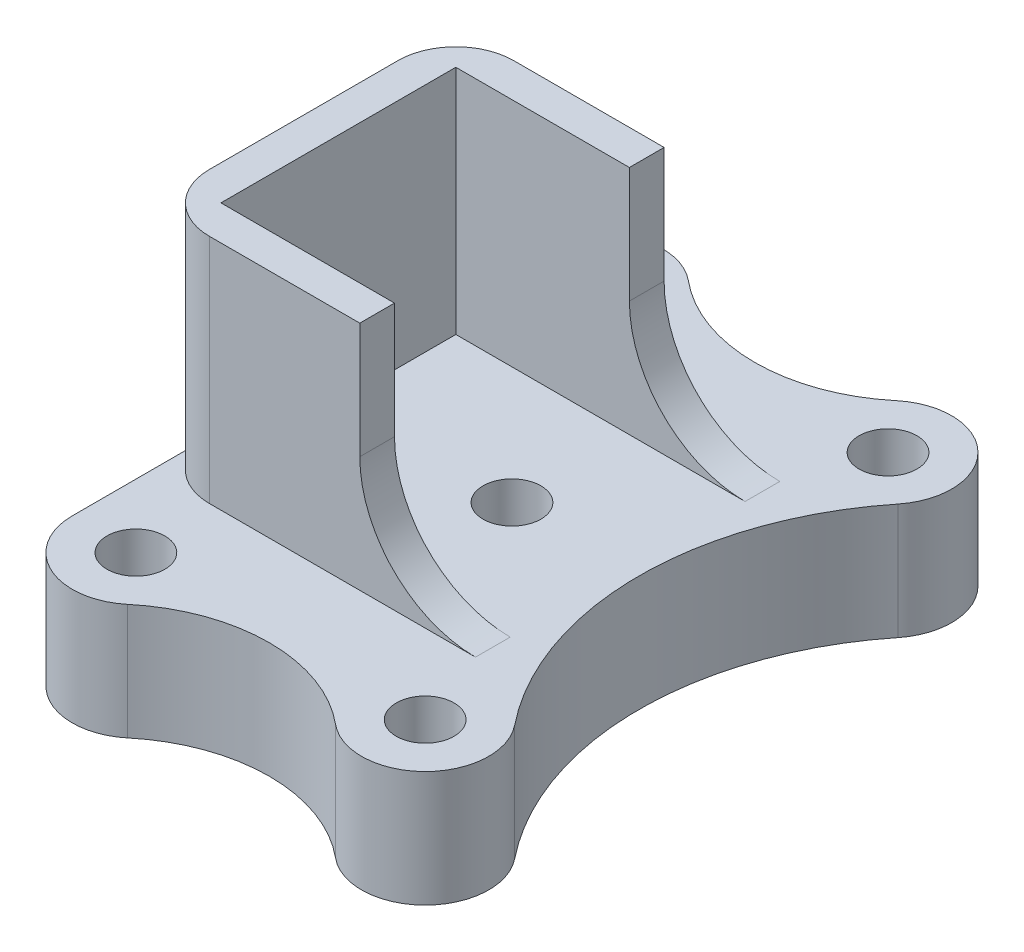
from build123d import *

# Parameters (mm, degrees)
SKETCH1_R           = 2.5
BOSS_EXTRUDE1_DEPTH = 10
SKETCH3_R           = 5.5
CUT_EXTRUDE1_DEPTH  = 4
BOSS_EXTRUDE2_DEPTH = 20
FILLET1_R           = 10
FILLET2_R           = 5


with BuildPart() as part:
    # Sketch1 → Boss-Extrude1 (new body)
    with BuildSketch(Plane(origin=(0, 0, 0), x_dir=(1, 0, 0), z_dir=(0, 1, 0))):
        with BuildLine():
            Line((-18, -20), (-18, 20))
            ThreePointArc((-18, 20), (-14.832854679, 24.980741817), (-8.978985802, 24.225217038))
            ThreePointArc((-8.978985802, 24.225217038), (0, 20.97437581), (8.978985802, 24.225217038))
            ThreePointArc((8.978985802, 24.225217038), (16.350007855, 23.927777936), (16.794778452, 16.564177238))
            ThreePointArc((16.794778452, 16.564177238), (10.984378813, 0), (16.794778452, -16.564177238))
            ThreePointArc((16.794778452, -16.564177238), (16.350007855, -23.927777936), (8.978985802, -24.225217038))
            ThreePointArc((8.978985802, -24.225217038), (0, -20.97437581), (-8.978985802, -24.225217038))
            ThreePointArc((-8.978985802, -24.225217038), (-14.832854679, -24.980741817), (-18, -20))
        make_face()
        with Locations(Location((-12.5, 20, 0), (0, 0, 270))):
            Circle(SKETCH1_R, mode=Mode.SUBTRACT)
        with Locations(Location((12.5, 20, 0), (0, 0, 90))):
            Circle(SKETCH1_R, mode=Mode.SUBTRACT)
        with Locations(Location((12.5, -20, 0), (0, 0, 270))):
            Circle(SKETCH1_R, mode=Mode.SUBTRACT)
        with Locations(Location((-12.5, -20, 0), (0, 0, 90))):
            Circle(SKETCH1_R, mode=Mode.SUBTRACT)
        with Locations(Location((0, 0, 0), (0, 0, 270))):
            Circle(SKETCH1_R, mode=Mode.SUBTRACT)
    extrude(amount=BOSS_EXTRUDE1_DEPTH)

    # Sketch3 → Cut-Extrude1 (cut)
    with BuildSketch(Plane.XZ):
        with Locations(Location((0, 0, 0), (0, 0, 270))):
            Circle(SKETCH3_R)
    extrude(amount=-CUT_EXTRUDE1_DEPTH, mode=Mode.SUBTRACT)

    # Sketch4 → Boss-Extrude2 (add)
    with BuildSketch(Plane(origin=(0, 10, 0), x_dir=(1, 0, 0), z_dir=(0, 1, 0))):
        Polygon((0, 10.15), (-15, 10.15), (-15, 0), (-15, -10.15), (0, -10.15), (0, -13.15), (-18, -13.15), (-18, 0), (-18, 13.15), (0, 13.15), align=None)
    extrude(amount=BOSS_EXTRUDE2_DEPTH)

    # Fillet1
    fillet1_edges = [part.edges().sort_by_distance(p)[0] for p in [
        (0, 10, -11.65),
        (0, 10, 11.65),
    ]]
    fillet(fillet1_edges, radius=FILLET1_R)

    # Fillet2
    fillet2_edges = [part.edges().sort_by_distance(p)[0] for p in [
        (-18, 20, -13.15),
        (-18, 20, 13.15),
    ]]
    fillet(fillet2_edges, radius=FILLET2_R)


solid = part.part
